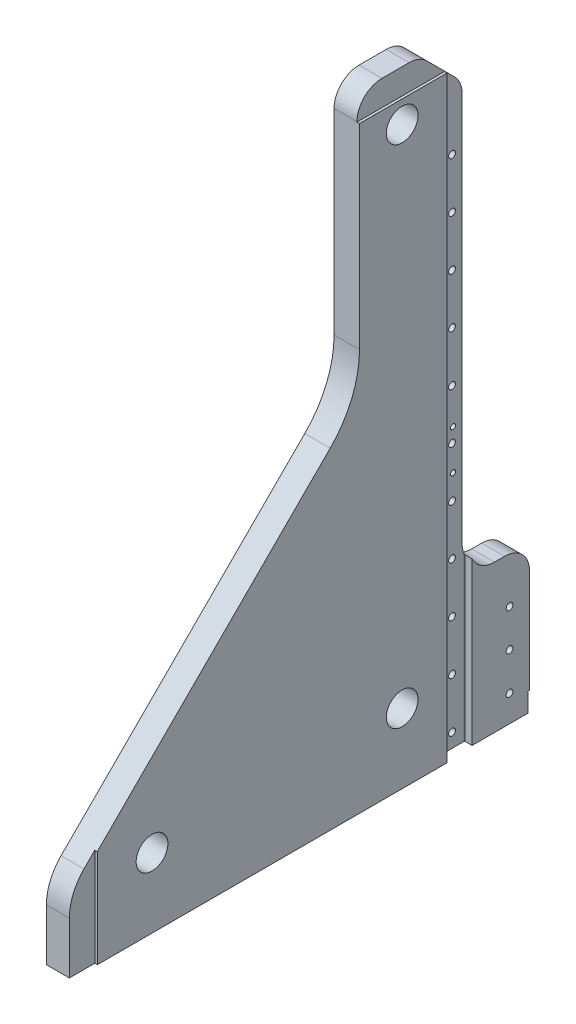
from build123d import *

# Parameters (mm, degrees)
BOSS_EXTRUDE1_DEPTH                                  = 50.8
SKETCH2_W                                            = 20
SKETCH2_H                                            = 55
CUT_EXTRUDE1_DEPTH                                   = 1485.951393144
SKETCH3_W                                            = 50.8
SKETCH3_H                                            = 5
CUT_EXTRUDE2_DEPTH                                   = 1553.894278436
SKETCH5_W                                            = 115
SKETCH5_H                                            = 323.205505282
CUT_EXTRUDE5_DEPTH                                   = 5
CUT_EXTRUDE6_START                                   = -27
SKETCH6_W                                            = 185
SKETCH6_H                                            = 150
CUT_EXTRUDE6_DEPTH                                   = 1458.401778495
FILLET1_R                                            = 38.1
M12_TAPPED_HOLE1_D                                   = 10.2
M12_TAPPED_HOLE1_DEPTH                               = 43.99
M12_TAPPED_HOLE1_TIP                                 = 3.064389157
CUT_EXTRUDE7_DEPTH                                   = 5.08
CBORE_FOR_M12_HEX_SOCKET_HEAD_CAP_SCREW1_D           = 13.5
CBORE_FOR_M12_HEX_SOCKET_HEAD_CAP_SCREW1_CBORE_D     = 20
CBORE_FOR_M12_HEX_SOCKET_HEAD_CAP_SCREW1_CBORE_DEPTH = 13
M12_TAPPED_HOLE2_D                                   = 10.2
M12_TAPPED_HOLE2_DEPTH                               = 43.99
M12_TAPPED_HOLE2_TIP                                 = 3.064389157
FILLET2_R                                            = 0.79375
FILLET3_R                                            = 0.79375
SKETCH16_W                                           = 225
SKETCH16_H                                           = 50.8
SKETCH16_W_2                                         = 50.8
SKETCH16_H_2                                         = 195.8
CUT_EXTRUDE8_DEPTH                                   = 1485.788752654
SKETCH17_R                                           = 31.75
SKETCH17_W                                           = 3.175
SKETCH17_H                                           = 38.1
CUT_EXTRUDE9_DEPTH                                   = 1485.951393147
SKETCH18_R                                           = 31.75
CUT_EXTRUDE10_DEPTH                                  = 1485.951393147


with BuildPart() as part:
    # Sketch1 → Boss-Extrude1 (new body)
    with BuildSketch(Plane(origin=(0, 0, 0), x_dir=(0, 0, -1), z_dir=(1, 0, 0))):
        with BuildLine():
            Line((0, 350), (0, 1129.289321881))
            ThreePointArc((0, 1129.289321881), (-3.806023374, 1148.4234935), (-14.644660941, 1164.644660941))
            Line((-14.644660941, 1164.644660941), (-85.355339059, 1235.355339059))
            ThreePointArc((-85.355339059, 1235.355339059), (-101.5765065, 1246.193976626), (-120.710678119, 1250))
            Line((-120.710678119, 1250), (-175, 1250))
            ThreePointArc((-175, 1250), (-210.355339059, 1235.355339059), (-225, 1200))
            Line((-225, 1200), (-225, 807.842712475))
            ThreePointArc((-225, 807.842712475), (-240.224093498, 731.306026002), (-283.578643763, 666.421356237))
            Line((-283.578643763, 666.421356237), (-770.710678119, 179.289321881))
            ThreePointArc((-770.710678119, 179.289321881), (-792.387953251, 146.846986999), (-800, 108.578643763))
            Line((-800, 108.578643763), (-800, 0))
            Line((-800, 0), (0, 0))
            Line((0, 0), (120, 0))
            Line((120, 0), (120, 250))
            ThreePointArc((120, 250), (105.355339059, 285.355339059), (70, 300))
            Line((70, 300), (50, 300))
            ThreePointArc((50, 300), (14.644660941, 314.644660941), (0, 350))
        make_face()
    extrude(amount=BOSS_EXTRUDE1_DEPTH)

    # Sketch2 → Cut-Extrude1 (cut, through all)
    with BuildSketch(Plane(origin=(0, 1250, 0), x_dir=(1, 0, 0), z_dir=(0, 1, 0))):
        with Locations((40.8, -22.5)):
            Rectangle(SKETCH2_W, SKETCH2_H)
    extrude(amount=-CUT_EXTRUDE1_DEPTH, mode=Mode.SUBTRACT)

    # Sketch3 → Cut-Extrude2 (cut, through all)
    with BuildSketch(Plane(origin=(0, 0, 800), x_dir=(-1, 0, 0), z_dir=(0, 0, -1))):
        with Locations((-25.4, 2.5)):
            Rectangle(SKETCH3_W, SKETCH3_H)
    extrude(amount=CUT_EXTRUDE2_DEPTH, mode=Mode.SUBTRACT)

    # Sketch5 → Cut-Extrude5 (cut)
    with BuildSketch(Plane(origin=(50.8, 0, 0), x_dir=(0, 0, -1), z_dir=(1, 0, 0))):
        with Locations((62.5, 166.602752641)):
            Rectangle(SKETCH5_W, SKETCH5_H)
    extrude(amount=-CUT_EXTRUDE5_DEPTH, mode=Mode.SUBTRACT)

    # Sketch6 → Cut-Extrude6 (cut, through all)
    with BuildSketch(Plane(origin=(30.8, 0, 0), x_dir=(0, 0, -1), z_dir=(1, 0, 0)).offset(CUT_EXTRUDE6_START)):
        with Locations((-92.5, 520)):
            Rectangle(SKETCH6_W, SKETCH6_H)
    extrude(amount=-CUT_EXTRUDE6_DEPTH, mode=Mode.SUBTRACT)

    # Fillet1
    fillet1_edges = [part.edges().sort_by_distance(p)[0] for p in [
        (1.9, 445, 185),
        (1.9, 595, 185),
    ]]
    fillet(fillet1_edges, radius=FILLET1_R)

    # M12 Tapped Hole1
    with Locations(Plane.ZY.offset(-3.8)):
        with Locations((150, 561), (18, 561), (18, 481), (150, 481)):
            Hole(M12_TAPPED_HOLE1_D / 2, depth=M12_TAPPED_HOLE1_DEPTH)
            with Locations((0, 0, -(M12_TAPPED_HOLE1_DEPTH + M12_TAPPED_HOLE1_TIP / 2))):  # 118° drill point
                Cone(0, M12_TAPPED_HOLE1_D / 2, M12_TAPPED_HOLE1_TIP, mode=Mode.SUBTRACT)

    # Sketch9 → Cut-Extrude7 (cut)
    with BuildSketch(Plane.ZY.offset(-3.8)):
        with BuildLine():
            Line((95, 544), (95, 498))
            ThreePointArc((95, 498), (89, 492), (83, 498))
            Line((83, 498), (83, 544))
            ThreePointArc((83, 544), (89, 550), (95, 544))
        make_face()
    extrude(amount=-CUT_EXTRUDE7_DEPTH, mode=Mode.SUBTRACT)

    # CBORE for M12 Hex Socket Head Cap Screw1 (through all)
    with Locations(Plane.ZY):
        with Locations((20, 33), (-80, 58), (-80, 133), (-80, 208), (20, 133), (20, 233), (20, 333), (20, 433), (20, 533), (20, 633), (20, 733), (20, 833), (20, 933), (20, 1033)):
            CounterBoreHole(CBORE_FOR_M12_HEX_SOCKET_HEAD_CAP_SCREW1_D / 2, CBORE_FOR_M12_HEX_SOCKET_HEAD_CAP_SCREW1_CBORE_D / 2, CBORE_FOR_M12_HEX_SOCKET_HEAD_CAP_SCREW1_CBORE_DEPTH)

    # M12 Tapped Hole2
    with Locations(Plane(origin=(0, 5, 0), x_dir=(-1, 0, 0), z_dir=(0, -1, 0))):
        with Locations((-25.8, 90), (-25.8, 30), (-25.8, -60), (-25.8, -140), (-25.8, -220), (-25.8, -380), (-25.8, -300), (-25.8, -460), (-25.8, -540), (-25.8, -620), (-25.8, -710), (-25.8, -770)):
            Hole(M12_TAPPED_HOLE2_D / 2, depth=M12_TAPPED_HOLE2_DEPTH)
            with Locations((0, 0, -(M12_TAPPED_HOLE2_DEPTH + M12_TAPPED_HOLE2_TIP / 2))):  # 118° drill point
                Cone(0, M12_TAPPED_HOLE2_D / 2, M12_TAPPED_HOLE2_TIP, mode=Mode.SUBTRACT)

    # Fillet2
    fillet2_edges = [part.edges().sort_by_distance(p)[0] for p in [
        (8.88, 550, 89),
        (8.88, 521, 95),
        (8.88, 492, 89),
        (8.88, 521, 83),
    ]]
    fillet(fillet2_edges, radius=FILLET2_R)

    # Fillet3
    fillet3_edges = [part.edges().sort_by_distance(p)[0] for p in [
        (30.8, 602.5, 50),
        (30.8, 166.602752641, -5),
    ]]
    fillet(fillet3_edges, radius=FILLET3_R)

    # Sketch16 → Cut-Extrude8 (cut, through all)
    with BuildSketch(Plane(origin=(45.8, 0, 0), x_dir=(0, 0, -1), z_dir=(1, 0, 0))):
        with Locations((-112.5, 1224.6)):
            Rectangle(SKETCH16_W, SKETCH16_H)
        with Locations((-774.6, 102.9)):
            Rectangle(SKETCH16_W_2, SKETCH16_H_2)
    extrude(amount=CUT_EXTRUDE8_DEPTH, mode=Mode.SUBTRACT)

    # Sketch17 → Cut-Extrude9 (cut, through all)
    with BuildSketch(Plane(origin=(50.8, 0, 0), x_dir=(0, 0, -1), z_dir=(1, 0, 0))):
        with Locations((-139.6896, 144.2936)):
            Circle(SKETCH17_R)
        with Locations((118.4125, 24.05)):
            Rectangle(SKETCH17_W, SKETCH17_H)
    extrude(amount=-CUT_EXTRUDE9_DEPTH, mode=Mode.SUBTRACT)

    # Sketch18 → Cut-Extrude10 (cut, through all)
    with BuildSketch(Plane(origin=(50.8, 0, 0), x_dir=(0, 0, -1), z_dir=(1, 0, 0))):
        with Locations((-639.6896, 144.2936)):
            Circle(SKETCH18_R)
        with Locations((-139.6896, 1155)):
            Circle(SKETCH18_R)
    extrude(amount=-CUT_EXTRUDE10_DEPTH, mode=Mode.SUBTRACT)


solid = part.part
